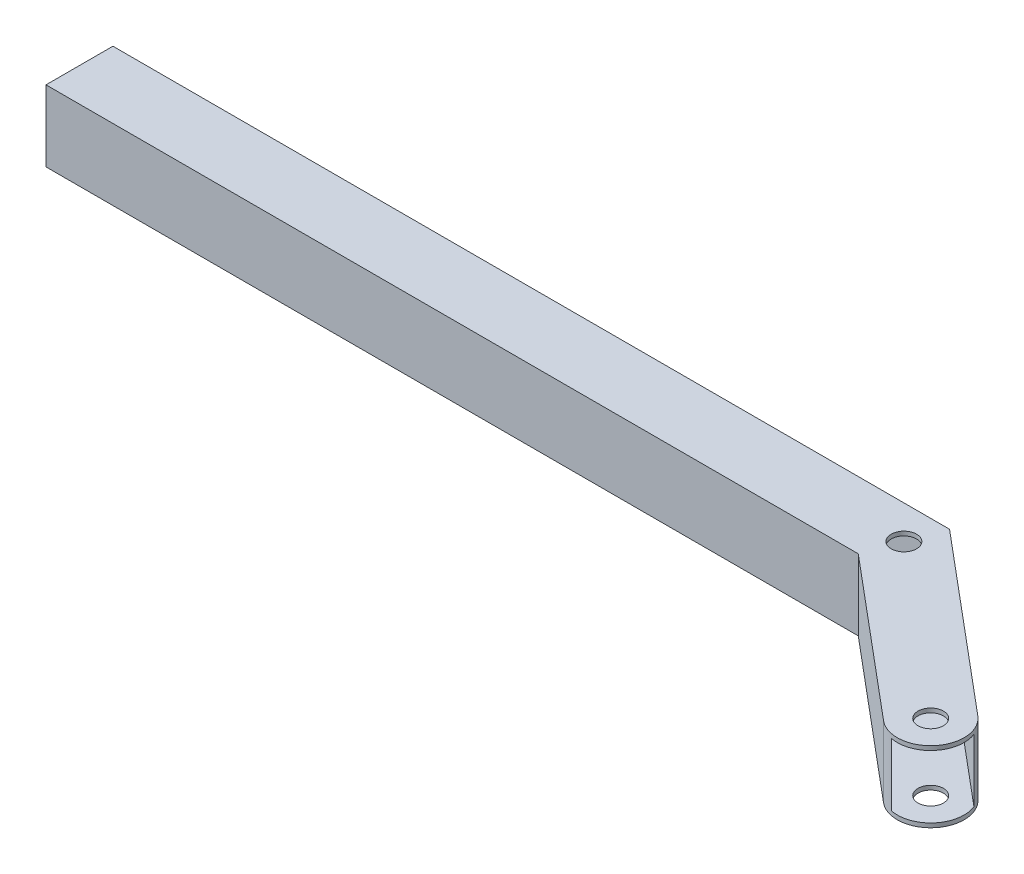
from build123d import *

# Parameters (mm, degrees)
BOSS_EXTRUDE1_DEPTH = 1.5875
BOSS_EXTRUDE2_DEPTH = 25.4
BOSS_EXTRUDE3_START = -1.5875
BOSS_EXTRUDE3_DEPTH = 1.5875
SKETCH7_R           = 4.826
CUT_EXTRUDE1_DEPTH  = 45.2755


with BuildPart() as part:
    # Sketch1 → Boss-Extrude1 (new body)
    with BuildSketch(Plane(origin=(0, 0, 0), x_dir=(1, 0, 0), z_dir=(0, 1, 0))):
        with BuildLine():
            Line((167.59049564, -102.48416143), (107.894507528, -52.393279822))
            Line((107.894507528, -52.393279822), (-200.411070496, -52.393279822))
            Line((-200.411070496, -52.393279822), (-200.411070496, -26.993279822))
            Line((-200.411070496, -26.993279822), (117.139351479, -26.993279822))
            Line((117.139351479, -26.993279822), (183.917300926, -83.026632574))
            ThreePointArc((183.917300926, -83.026632574), (185.482662711, -100.918799645), (167.59049564, -102.48416143))
        make_face()
    extrude(amount=BOSS_EXTRUDE1_DEPTH)

    # Sketch2 → Boss-Extrude2 (add)
    with BuildSketch(Plane(origin=(0, 1.5875, 0), x_dir=(1, 0, 0), z_dir=(0, 1, 0))):
        with BuildLine():
            Line((187.606793422, -88.194818438), (117.139351479, -29.065613894))
            Line((117.139351479, -29.065613894), (117.139351479, -28.580779822))
            Line((117.139351479, -28.580779822), (116.561548732, -28.580779822))
            Line((116.561548732, -28.580779822), (116.118926148, -28.209375376))
            Line((116.118926148, -28.209375376), (115.807280814, -28.580779822))
            Line((115.807280814, -28.580779822), (-200.411070496, -28.580779822))
            Line((-200.411070496, -28.580779822), (-200.411070496, -26.993279822))
            Line((-200.411070496, -26.993279822), (117.139351479, -26.993279822))
            Line((117.139351479, -26.993279822), (183.917300926, -83.026632574))
            ThreePointArc((183.917300926, -83.026632574), (186.090270011, -85.376412011), (187.606793422, -88.194818438))
        make_face()
        with BuildLine():
            Line((-200.411070496, -52.393279822), (-200.411070496, -50.805779822))
            Line((-200.411070496, -50.805779822), (108.472310275, -50.805779822))
            Line((108.472310275, -50.805779822), (173.320838796, -105.220156187))
            ThreePointArc((173.320838796, -105.220156187), (170.281908769, -104.216083315), (167.59049564, -102.48416143))
            Line((167.59049564, -102.48416143), (107.894507528, -52.393279822))
            Line((107.894507528, -52.393279822), (-200.411070496, -52.393279822))
        make_face()
    extrude(amount=BOSS_EXTRUDE2_DEPTH)

    # Sketch6 → Boss-Extrude3 (add)
    with BuildSketch(Plane(origin=(0, 26.9875, 0), x_dir=(1, 0, 0), z_dir=(0, 1, 0)).offset(BOSS_EXTRUDE3_START)):
        with BuildLine():
            Line((-200.411070496, -26.993279822), (117.139351479, -26.993279822))
            Line((117.139351479, -26.993279822), (183.917300926, -83.026632574))
            ThreePointArc((183.917300926, -83.026632574), (185.482662711, -100.918799645), (167.59049564, -102.48416143))
            Line((167.59049564, -102.48416143), (107.894507528, -52.393279822))
            Line((107.894507528, -52.393279822), (-200.411070496, -52.393279822))
            Line((-200.411070496, -52.393279822), (-200.411070496, -26.993279822))
        make_face()
    extrude(amount=BOSS_EXTRUDE3_DEPTH)

    # Sketch7 → Cut-Extrude1 (cut)
    with BuildSketch(Plane(origin=(0, 26.9875, 0), x_dir=(1, 0, 0), z_dir=(0, 1, 0))):
        with Locations(Location((175.753898283, -92.755397002, 0), (0, 0, 270))):
            Circle(SKETCH7_R)
        with Locations(Location((112.516929504, -39.693279822, 0), (0, 0, 270))):
            Circle(SKETCH7_R)
    extrude(amount=-CUT_EXTRUDE1_DEPTH, mode=Mode.SUBTRACT)


solid = part.part
